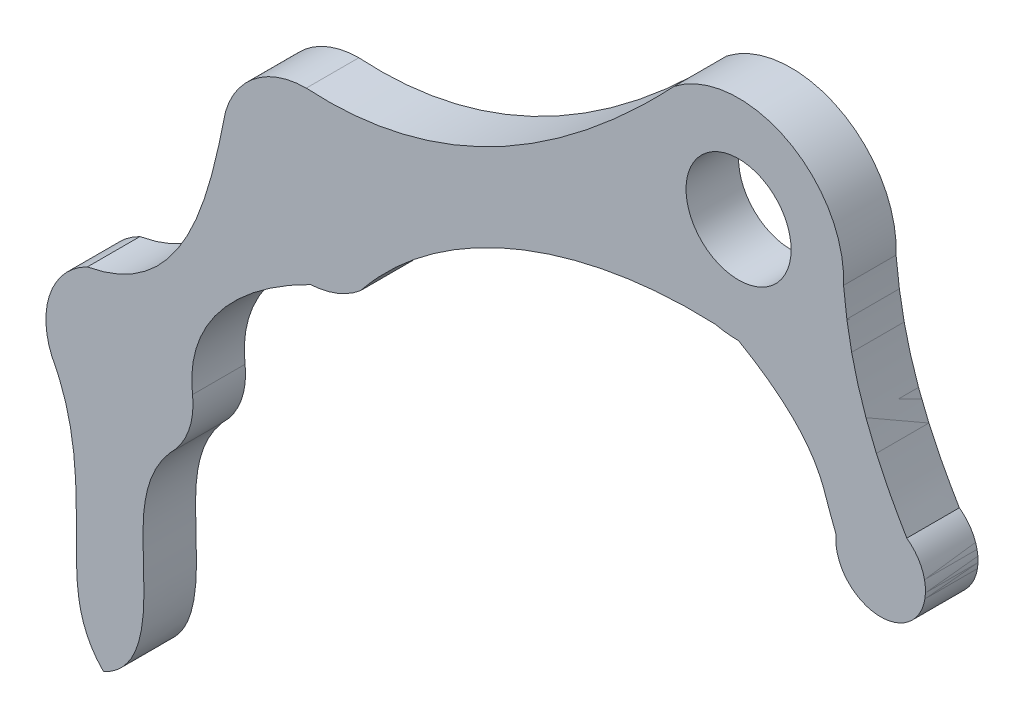
from build123d import *

# Parameters (mm, degrees)
CROQUIS1_R              = 5.000000002
SALIENTE_EXTRUIR1_DEPTH = 5
SALIENTE_EXTRUIR2_START = -5
CROQUIS2_R              = 4.26743785
SALIENTE_EXTRUIR2_DEPTH = 5


with BuildPart() as part:
    # Croquis1 → Saliente-Extruir1 (new body)
    with BuildSketch(Plane(origin=(0, 0, 0), x_dir=(-1, 0, 0), z_dir=(0, 0, -1))):
        with BuildLine():
            ThreePointArc((65.366552273, -43.922636472), (65.468760949, -38.737894565), (61.975170701, -34.905555535))
            add(Edge.make_bspline(
                [(48.815695063, -15.501711479), (50.328955685, -23.082906451), (52.395963263, -33.157522067), (61.975170701, -34.905555535)],
                knots=[0, 0, 0, 0, 1, 1, 1, 1], degree=3))
            ThreePointArc((48.815695063, -15.501711479), (45.934799024, -11.346655018), (41.137795802, -9.748901511))
            add(Edge.make_bspline(
                [(6.131666021, 7.899536167), (15.139972032, -1.656202419), (27.24511665, -10.665918482), (41.137795802, -9.748901511)],
                knots=[0, 0, 0, 0, 1, 1, 1, 1], degree=3))
            ThreePointArc((6.131666021, 7.899536167), (-4.598441285, 8.879996497), (-9.989918973, -0.448908775))
            add(Edge.make_bspline(
                [(-16.008618179, -18.26686517), (-15.797694107, -17.895825564), (-12.262638843, -11.871150313), (-10.546593735, -6.581162345), (-9.989918973, -0.448908775)],
                knots=[0, 0, 0, 0, 0.04039471, 0.656610986, 0.656610986, 0.656610986, 0.656610986], degree=3))
            ThreePointArc((-16.008618179, -18.26686517), (-11.761967136, -17.845761098), (-9.273993033, -21.312944188))
            add(Edge.make_bspline(
                [(-9e-09, -10.000000002), (-2.926729974, -11.686757621), (-7.513439547, -15.000663628), (-8.673577005, -19.940680978), (-9.273993033, -21.312944188)],
                knots=[0, 0, 0, 0, 0.464305351, 0.659664826, 0.659664826, 0.659664826, 0.659664826], degree=3))
            ThreePointArc((-9e-09, -10.000000002), (1.120487591, -9.937027099), (2.22686312, -9.748901509))
            add(Edge.make_bspline(
                [(35.978828296, -23.863233377), (28.058119493, -13.940958986), (14.675184196, -9.205569704), (2.22686312, -9.748901509)],
                knots=[0, 0, 0, 0, 1, 1, 1, 1], degree=3))
            ThreePointArc((35.978828296, -23.863233377), (38.199491242, -25.189759407), (40.727345447, -25.738365226))
            add(Edge.make_bspline(
                [(51.96076037, -40.419223819), (52.800264101, -33.487834784), (46.144416797, -28.374213166), (40.727345447, -25.738365226)],
                knots=[0, 0, 0, 0, 1, 1, 1, 1], degree=3))
            ThreePointArc((51.96076037, -40.419223819), (52.348210074, -43.621422867), (54.130381087, -46.309928491))
            add(Edge.make_bspline(
                [(60.429953363, -67.492405783), (57.103333259, -65.904114864), (55.916753892, -57.608938241), (57.449959784, -50.201518935), (54.130381087, -46.309928491)],
                knots=[0, 0, 0, 0, 0.425583063, 1, 1, 1, 1], degree=3))
            add(Edge.make_bspline(
                [(65.366552273, -43.922636472), (62.948824726, -48.37679887), (63.028170153, -56.438278724), (63.035847799, -64.90708051), (60.429953363, -67.492405783)],
                knots=[0, 0, 0, 0, 0.588886368, 1, 1, 1, 1], degree=3))
        make_face()
        with Locations(Location((-9e-09, -2e-09, 0), (0, 0, 180))):
            Circle(CROQUIS1_R, mode=Mode.SUBTRACT)
    extrude(amount=-SALIENTE_EXTRUIR1_DEPTH)

    # Croquis2 → Saliente-Extruir2 (add)
    with BuildSketch(Plane.XY.offset(5).offset(SALIENTE_EXTRUIR2_START)):
        with Locations((13.520610478, -21.733973978)):
            Circle(CROQUIS2_R)
    extrude(amount=SALIENTE_EXTRUIR2_DEPTH)


solid = part.part
